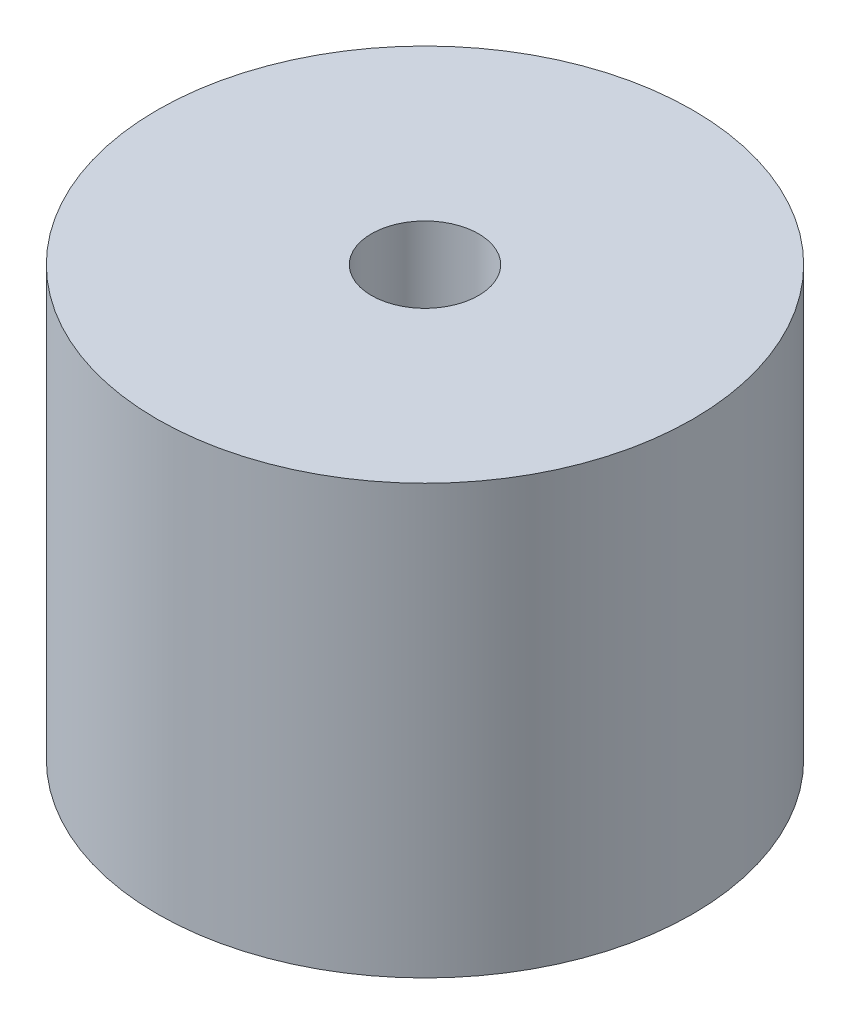
from build123d import *

# Parameters (mm, degrees)
SKETCH1_R           = 12.5
SKETCH1_R_2         = 2.5
BOSS_EXTRUDE1_DEPTH = 20


with BuildPart() as part:
    # Sketch1 → Boss-Extrude1 (new body)
    with BuildSketch(Plane(origin=(0, 0, 0), x_dir=(1, 0, 0), z_dir=(0, 1, 0))):
        with Locations(Location((-6.31474002, 6.446297103, 0), (0, 0, 270))):
            Circle(SKETCH1_R)
        with Locations(Location((-6.31474002, 6.446297103, 0), (0, 0, 270))):
            Circle(SKETCH1_R_2, mode=Mode.SUBTRACT)
    extrude(amount=BOSS_EXTRUDE1_DEPTH)


solid = part.part
